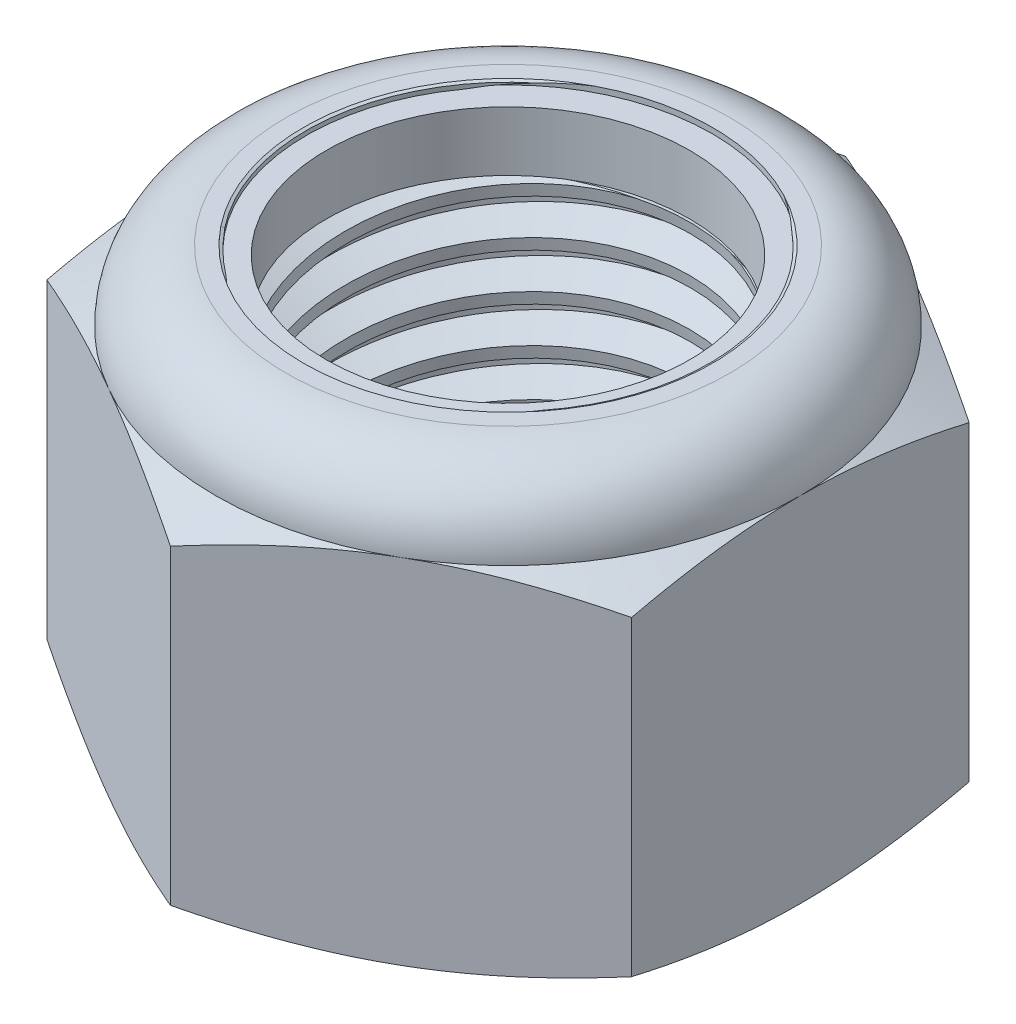
from build123d import *

# Parameters (mm, degrees)
EXTRUDE1_DEPTH       = 11.509375
SKETCH2_W            = 5.5499
SKETCH2_H            = 11.509375
LPATTERN1_COUNT      = 9
LPATTERN1_PITCH      = 1.27
LPATTERN1_COUNT_DIR2 = 2
LPATTERN1_PITCH_DIR2 = 1.27


with BuildPart() as part:
    # Sketch1 → Extrude1 (new body)
    with BuildSketch(Plane(origin=(0, 0, 0), x_dir=(1, 0, 0), z_dir=(0, 1, 0))):
        Polygon((0, 9.165435523), (-7.9375, 4.582717762), (-7.9375, -4.582717762), (0, -9.165435523), (7.9375, -4.582717762), (7.9375, 4.582717762), align=None)
    extrude(amount=EXTRUDE1_DEPTH)

    # Sketch4 → Cut-Revolve2 (revolve, cut)
    with BuildSketch(Plane(origin=(0, 0, 0), x_dir=(0, 0, -1), z_dir=(1, 0, 0))):
        Polygon((0, 11.509375), (5.5499, 11.509375), (4.930108683, 11.220361563), (4.930108683, 0.289013437), (5.5499, 0), (0, 0), align=None)
    revolve(axis=Axis((0, 11.509375, 0), (0, 1, 0)), mode=Mode.SUBTRACT)


with BuildPart() as body_2:
    # Sketch2 → Revolve1 (revolve)
    with BuildSketch(Plane(origin=(0, 0, 0), x_dir=(0, 0, -1), z_dir=(1, 0, 0))):
        with Locations((2.77495, 5.7546875)):
            Rectangle(SKETCH2_W, SKETCH2_H)
    revolve(axis=Axis((0, -5.5499, 0), (0, 1, 0)))

    # Sketch3 → Cut-Revolve1 (revolve, cut)
    with BuildSketch(Plane(origin=(0, 0, 0), x_dir=(0, 0, -1), z_dir=(1, 0, 0))):
        Polygon((5.567945879, 11.351654016), (5.694267033, 10.247607129), (4.966200442, 10.56376864), (4.930108683, 10.879210608), align=None)
    cut_revolve1 = revolve(axis=Axis((0, 11.509375, 0.154924003), (0, -0.9935180084796014, -0.11367482934549246)), mode=Mode.SUBTRACT)

    # LPattern1: Cut-Revolve1 9 × 2
    with Locations(*[Vector(0, -1, 0) * (i * LPATTERN1_PITCH) + Vector(0, 1, 0) * (j * LPATTERN1_PITCH_DIR2) for i in range(LPATTERN1_COUNT) for j in range(LPATTERN1_COUNT_DIR2) if (i, j) != (0, 0)]):
        add(cut_revolve1, mode=Mode.SUBTRACT)


with BuildPart() as part_1:
    add(part.part)

    # Combine1: cut body 2
    add(body_2.part, mode=Mode.SUBTRACT)

    # Sketch5 → Cut-Revolve3 (revolve, cut)
    with BuildSketch(Plane(origin=(0, 0, 0), x_dir=(0, 0, -1), z_dir=(1, 0, 0))):
        with BuildLine():
            Line((0, 0), (7.9375, 0))
            Line((7.9375, 0), (9.165435523, 0.572595738))
            Line((9.165435523, 0.572595738), (9.165435523, 9.018550095))
            Line((9.165435523, 9.018550095), (7.9375, 9.591145833))
            ThreePointArc((7.9375, 9.591145833), (7.375663685, 10.947538685), (6.019270833, 11.509375))
            Line((6.019270833, 11.509375), (6.019270833, 12.779375))
            Line((6.019270833, 12.779375), (10.435435523, 12.779375))
            Line((10.435435523, 12.779375), (10.435435523, -1.27))
            Line((10.435435523, -1.27), (0, -1.27))
            Line((0, -1.27), (0, 0))
        make_face()
    revolve(axis=Axis((0, 0, 0), (0, 1, 0)), mode=Mode.SUBTRACT)

    # Sketch6 → Cut-Revolve4 (revolve, cut)
    with BuildSketch(Plane(origin=(0, 0, 0), x_dir=(0, 0, -1), z_dir=(1, 0, 0))):
        with BuildLine():
            Line((0, 9.591145833), (7.7851, 9.591145833))
            ThreePointArc((7.7851, 9.591145833), (7.267900612, 10.839775612), (6.019270833, 11.356975))
            Line((6.019270833, 11.356975), (5.474689758, 11.356975))
            Line((5.474689758, 11.356975), (5.474689758, 12.779375))
            Line((5.474689758, 12.779375), (0, 12.779375))
            Line((0, 12.779375), (0, 9.591145833))
        make_face()
    revolve(axis=Axis((0, 12.779375, 0), (0, 1, 0)), mode=Mode.SUBTRACT)


with BuildPart() as body_2_2:
    # Sketch7 → Revolve2 (revolve)
    with BuildSketch(Plane(origin=(0, 0, 0), x_dir=(0, 0, -1), z_dir=(1, 0, 0))):
        with BuildLine():
            Line((4.930108683, 9.667345833), (7.707180867, 9.667345833))
            ThreePointArc((7.707180867, 9.667345833), (7.18676751, 10.812537757), (6.019270833, 11.280775))
            Line((6.019270833, 11.280775), (4.930108683, 11.280775))
            Line((4.930108683, 11.280775), (4.930108683, 9.667345833))
        make_face()
    revolve(axis=Axis((0, 9.667345833, 0), (0, 1, 0)))


solid = Compound([part_1.part, body_2_2.part])
